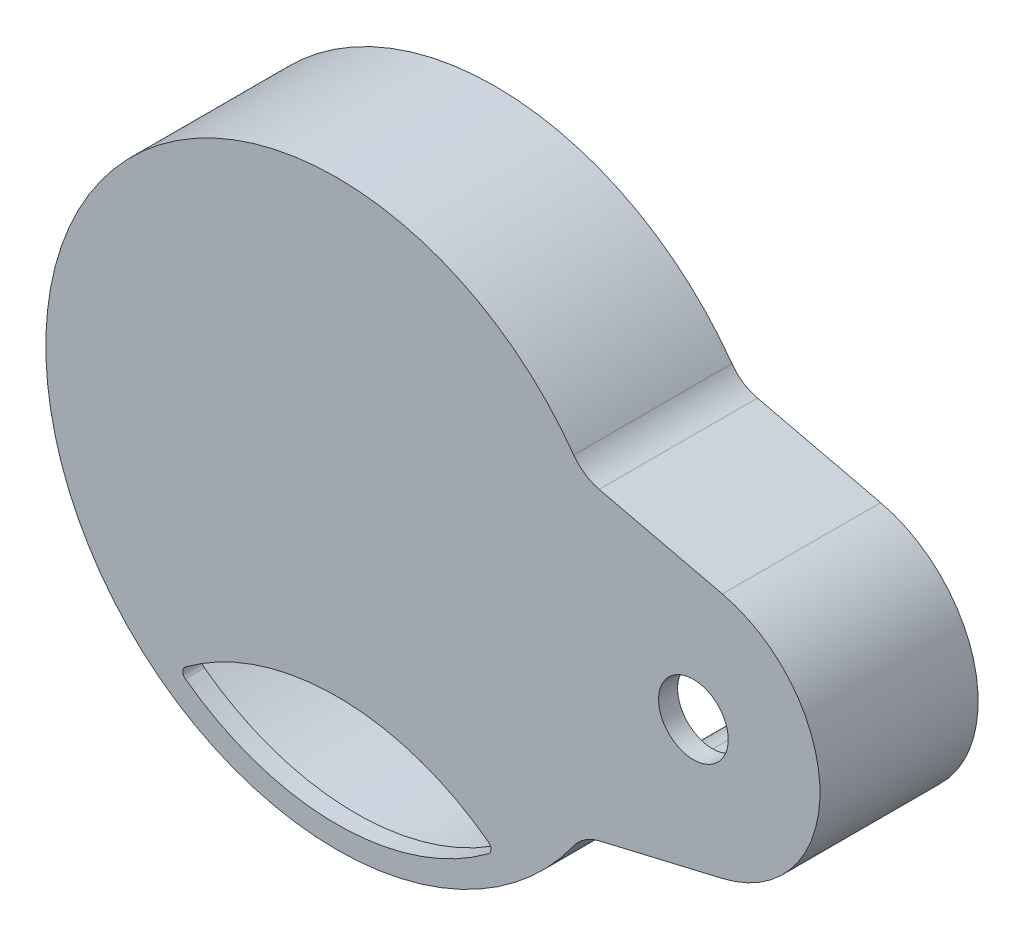
from build123d import *

# Parameters (mm, degrees)
SALIENTE_EXTRUIR1_DEPTH = 25
SALIENTE_EXTRUIR2_START = -3
SALIENTE_EXTRUIR2_DEPTH = 3
CORTAR_EXTRUIR1_DEPTH   = 3
CROQUIS4_R              = 5.5
CORTAR_EXTRUIR2_DEPTH   = 3


with BuildPart() as part:
    # Croquis1 → Saliente-Extruir1 (new body)
    with BuildSketch(Plane.XY):
        with BuildLine():
            Line((41.445702238, 24.048980806), (60.914091522, 19.468389284))
            ThreePointArc((60.914091522, 19.468389284), (76.3335, 0), (60.914091522, -19.468389284))
            Line((60.914091522, -19.468389284), (41.445702238, -24.048980806))
            ThreePointArc((41.445702238, -24.048980806), (39.191168738, -25.031281724), (37.426574478, -26.744186711))
            ThreePointArc((37.426574478, -26.744186711), (-46, 2.97e-07), (37.426574823, 26.744186228))
            ThreePointArc((37.426574823, 26.744186228), (39.191168984, 25.031281559), (41.445702238, 24.048980806))
        make_face()
        with BuildLine():
            Line((40.758613509, 21.128722413), (60.227002793, 16.548130891))
            ThreePointArc((60.227002793, 16.548130891), (73.3335, 0), (60.227002793, -16.548130891))
            Line((60.227002793, -16.548130891), (40.758613509, -21.128722413))
            ThreePointArc((40.758613509, -21.128722413), (37.520298481, -22.539657237), (34.985711121, -25.000000347))
            ThreePointArc((34.985711121, -25.000000347), (-43, 4.27e-07), (34.985711617, 24.999999653))
            ThreePointArc((34.985711617, 24.999999653), (37.520298835, 22.539656999), (40.758613509, 21.128722413))
        make_face(mode=Mode.SUBTRACT)
    extrude(amount=SALIENTE_EXTRUIR1_DEPTH)

    # Croquis2 → Saliente-Extruir2 (add)
    with BuildSketch(Plane.XY.offset(25).offset(SALIENTE_EXTRUIR2_START)):
        with BuildLine():
            Line((41.445702238, -24.048980806), (60.914091522, -19.468389284))
            ThreePointArc((60.914091522, -19.468389284), (76.3335, 0), (60.914091522, 19.468389284))
            Line((60.914091522, 19.468389284), (41.445702238, 24.048980806))
            ThreePointArc((41.445702238, 24.048980806), (39.191168984, 25.031281559), (37.426574823, 26.744186228))
            ThreePointArc((37.426574823, 26.744186228), (-46, 2.97e-07), (37.426574478, -26.744186711))
            ThreePointArc((37.426574478, -26.744186711), (39.191168738, -25.031281724), (41.445702238, -24.048980806))
        make_face()
    extrude(amount=SALIENTE_EXTRUIR2_DEPTH)

    # Croquis3 → Cortar-Extruir1 (cut)
    with BuildSketch(Plane.XY.offset(25)):
        with BuildLine():
            ThreePointArc((-23.947692308, -34.562794151), (-24.349, -33.76181505), (-23.947692308, -32.960835948))
            ThreePointArc((-23.947692308, -32.960835948), (0, -25), (23.947692308, -32.960835948))
            ThreePointArc((23.947692308, -32.960835948), (24.349, -33.76181505), (23.947692308, -34.562794151))
            ThreePointArc((23.947692308, -34.562794151), (0, -42.523630099), (-23.947692308, -34.562794151))
        make_face()
    extrude(amount=-CORTAR_EXTRUIR1_DEPTH, mode=Mode.SUBTRACT)

    # Croquis4 → Cortar-Extruir2 (cut)
    with BuildSketch(Plane.XY.offset(25)):
        with Locations((56.3335, 0)):
            Circle(CROQUIS4_R)
    extrude(amount=-CORTAR_EXTRUIR2_DEPTH, mode=Mode.SUBTRACT)


solid = part.part
